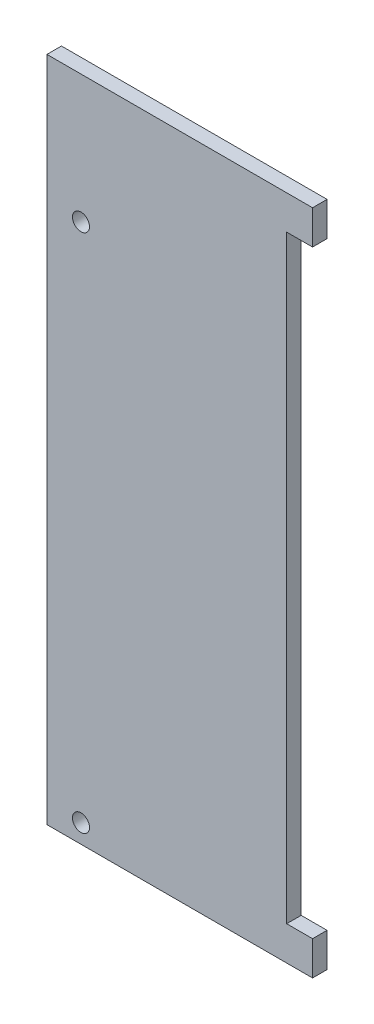
from build123d import *

# Parameters (mm, degrees)
SKETCH1_R           = 3.175
BOSS_EXTRUDE1_DEPTH = 5.4102


with BuildPart() as part:
    # Sketch1 → Boss-Extrude1 (new body)
    with BuildSketch(Plane.XY):
        Polygon((39.878, 111.68888), (49.53, 111.68888), (49.53, 124.38888), (-49.53, 124.38888), (-49.53, -124.38888), (49.53, -124.38888), (49.53, -111.68888), (39.878, -111.68888), align=None)
        with Locations((-36.83, -117.40388)):
            Circle(SKETCH1_R, mode=Mode.SUBTRACT)
        with Locations((-36.83, 76.63688)):
            Circle(SKETCH1_R, mode=Mode.SUBTRACT)
    extrude(amount=BOSS_EXTRUDE1_DEPTH)


solid = part.part
